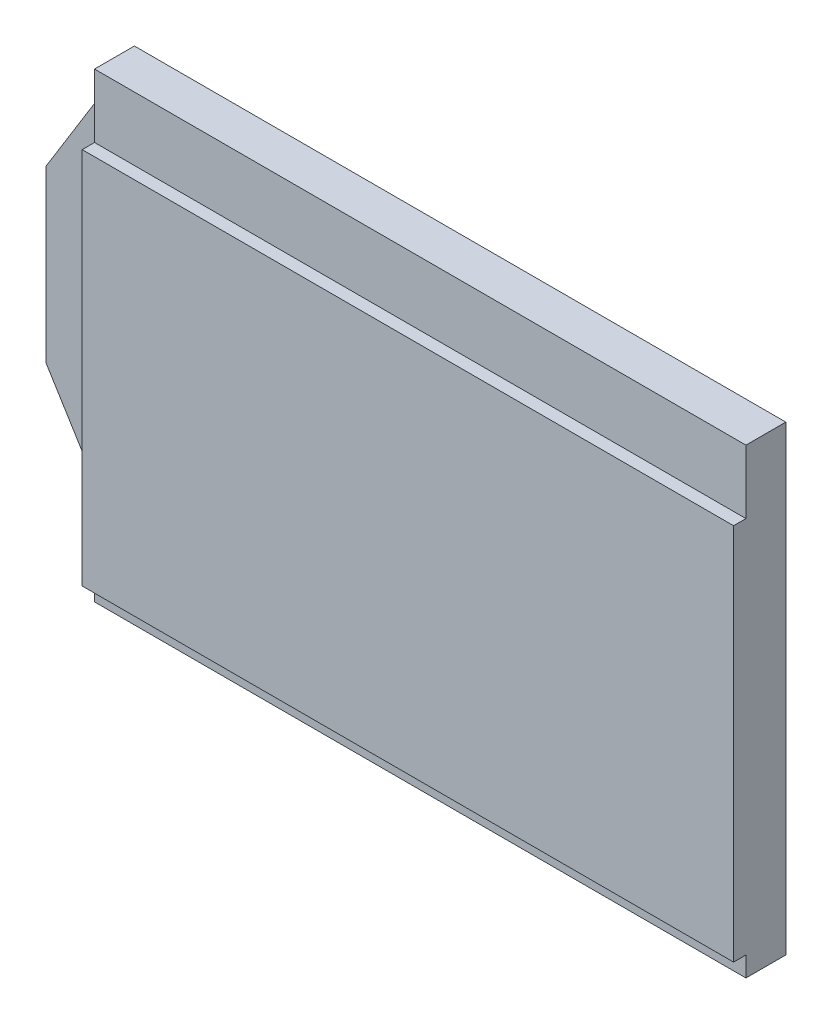
from build123d import *

# Parameters (mm, degrees)
SZKIC1_W                    = 68.6
SZKIC1_H                    = 48.6
DODANIE_WYCI_GNI_CIE1_DEPTH = 4.2
SZKIC2_W                    = 68.6
SZKIC2_H                    = 39.8
DODANIE_WYCI_GNI_CIE2_DEPTH = 1.3
DODANIE_WYCI_GNI_CIE3_DEPTH = 2.5


with BuildPart() as part:
    # Szkic1 → Dodanie-wyciągnięcie1 (new body)
    with BuildSketch(Plane.XY):
        Rectangle(SZKIC1_W, SZKIC1_H)
    extrude(amount=DODANIE_WYCI_GNI_CIE1_DEPTH)

    # Szkic2 → Dodanie-wyciągnięcie2 (add)
    with BuildSketch(Plane.XY.offset(4.2)):
        with Locations((0, -2.3)):
            Rectangle(SZKIC2_W, SZKIC2_H)
    extrude(amount=DODANIE_WYCI_GNI_CIE2_DEPTH)


with BuildPart() as body_2:
    # Szkic3 → Dodanie-wyciągnięcie3 (new body)
    with BuildSketch(Plane(origin=(0, 0, 0), x_dir=(-1, 0, 0), z_dir=(0, 0, -1))):
        Polygon((34.3, 22.218863192), (41.090373398, 11.218863192), (41.090373398, -6.781136808), (34.3, -17.781136808), align=None)
    extrude(amount=-DODANIE_WYCI_GNI_CIE3_DEPTH)


solid = Compound([part.part, body_2.part])
